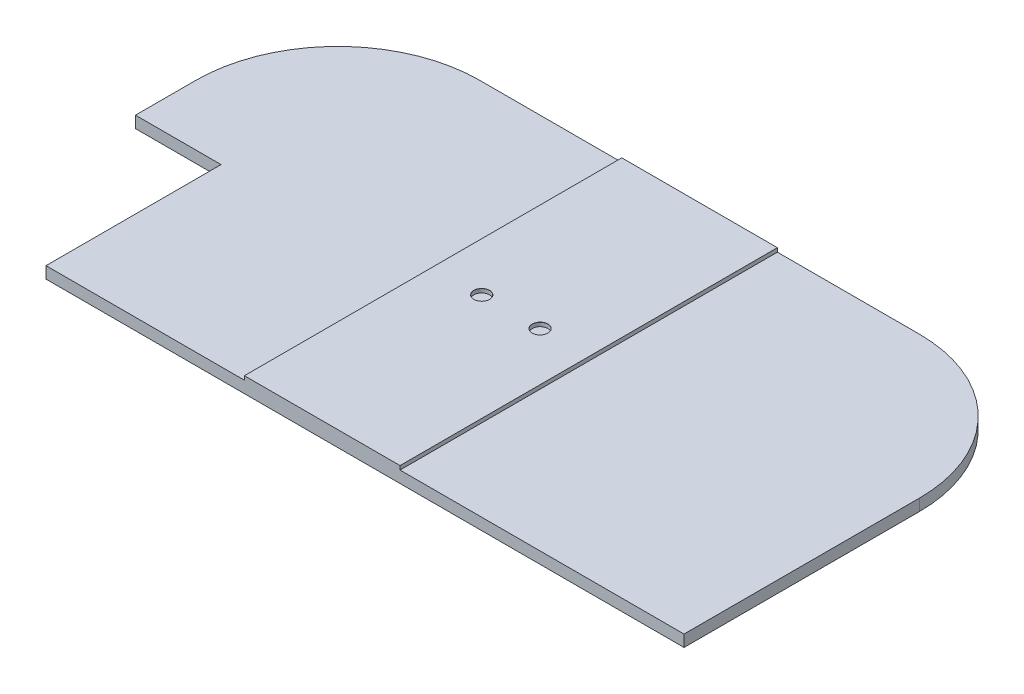
from build123d import *

# Parameters (mm, degrees)
SKETCH_1_W           = 40
SKETCH_1_H           = 97
EXTRUDE_1_DEPTH      = 1
F_4_0MM_1_AT_2_COUNT = 2
F_4_0MM_1_AT_2_PITCH = 15
EXTRUDE_START        = -1
SKETCH_6_2_W         = 186
SKETCH_6_2_H         = 97
EXTRUDE_3_DEPTH      = 3
FILLET_2_R           = 36.5
SKETCH_8_W           = 22
SKETCH_8_H           = 45
CUT_EXTRUDE_2_DEPTH  = 105.929738397


with BuildPart() as part:
    # 草圖1 → 填料-伸長1 (new body)
    with BuildSketch(Plane(origin=(0, 0, 0), x_dir=(1, 0, 0), z_dir=(0, 1, 0))):
        Rectangle(SKETCH_1_W, SKETCH_1_H)
    extrude(amount=EXTRUDE_1_DEPTH)

    # 草圖5 → Ø4.0mm 定位孔1 (revolve, cut)
    with BuildSketch(Plane(origin=(7.5, 1, 0), x_dir=(0, 0, 1), z_dir=(1, 0, 0))):
        Polygon((0, 0), (0, 1), (2, 1), (2, 0.025), (2.025, 0), align=None)
    f_4_0mm_1 = revolve(axis=Axis((7.5, 7.35, 0), (0, -1, 0)), mode=Mode.SUBTRACT)

    # Ø4.0mm 定位孔1 at 2: Ø4.0mm 定位孔1 ×2
    with Locations(*[(-i * F_4_0MM_1_AT_2_PITCH, 0, 0) for i in range(1, F_4_0MM_1_AT_2_COUNT)]):
        add(f_4_0mm_1, mode=Mode.SUBTRACT)

    # 草圖6<2> → 填料-伸長3 (add)
    with BuildSketch(Plane(origin=(0, 1, 0), x_dir=(1, 0, 0), z_dir=(0, 1, 0)).offset(EXTRUDE_START)):
        Rectangle(SKETCH_6_2_W, SKETCH_6_2_H)
    extrude(amount=-EXTRUDE_3_DEPTH)

    # 圓角2
    fillet_2_edges = [part.edges().sort_by_distance(p)[0] for p in [
        (-93, -1.5, -48.5),
        (93, -1.5, -48.5),
    ]]
    fillet(fillet_2_edges, radius=FILLET_2_R)

    # 草圖8 → 除料-伸長2 (cut, through all)
    with BuildSketch(Plane(origin=(0, 0, 0), x_dir=(1, 0, 0), z_dir=(0, 1, 0))):
        with Locations((-82, -26)):
            Rectangle(SKETCH_8_W, SKETCH_8_H)
    extrude(amount=-CUT_EXTRUDE_2_DEPTH, mode=Mode.SUBTRACT)


solid = part.part
